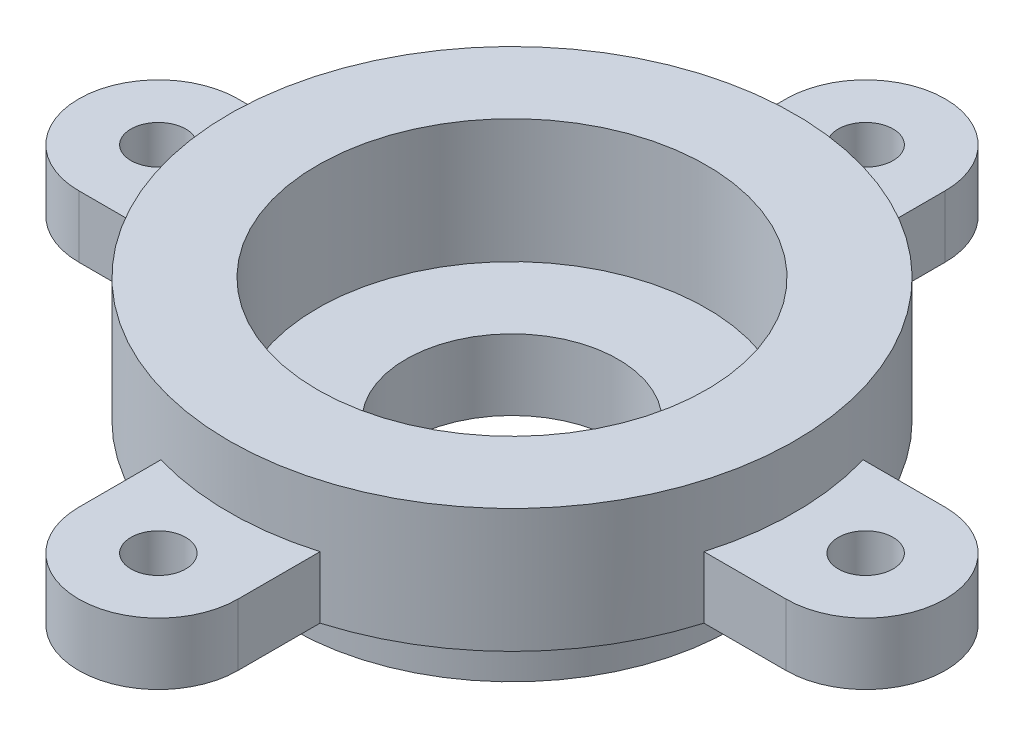
from build123d import *

# Parameters (mm, degrees)
SKETCH1_R           = 12.45
SKETCH1_R_2         = 6
BOSS_EXTRUDE1_DEPTH = 4
SKETCH2_R           = 16
SKETCH2_R_2         = 11
BOSS_EXTRUDE2_DEPTH = 7
BOSS_EXTRUDE3_START = -7
SKETCH3_R           = 1.55
BOSS_EXTRUDE3_DEPTH = 3.5
CIRPATTERN1_COUNT   = 4


with BuildPart() as part:
    # Sketch1 → Boss-Extrude1 (new body)
    with BuildSketch(Plane(origin=(0, 0, 0), x_dir=(1, 0, 0), z_dir=(0, 1, 0))):
        with Locations(Location((0, 0, 0), (0, 0, 270))):
            Circle(SKETCH1_R)
        with Locations(Location((0, 0, 0), (0, 0, 270))):
            Circle(SKETCH1_R_2, mode=Mode.SUBTRACT)
    extrude(amount=BOSS_EXTRUDE1_DEPTH)

    # Sketch2 → Boss-Extrude2 (add)
    with BuildSketch(Plane(origin=(0, 4, 0), x_dir=(1, 0, 0), z_dir=(0, 1, 0))):
        with Locations(Location((0, 0, 0), (0, 0, 270))):
            Circle(SKETCH2_R)
        with Locations(Location((0, 0, 0), (0, 0, 270))):
            Circle(SKETCH2_R_2, mode=Mode.SUBTRACT)
    extrude(amount=BOSS_EXTRUDE2_DEPTH)

    # Sketch3 → Boss-Extrude3 (add)
    with BuildSketch(Plane(origin=(0, 11, 0), x_dir=(1, 0, 0), z_dir=(0, 1, 0)).offset(BOSS_EXTRUDE3_START)):
        with BuildLine():
            Line((-4.5, 20), (-4.5, 15.354152533))
            ThreePointArc((-4.5, 15.354152533), (0, 16), (4.5, 15.354152533))
            Line((4.5, 15.354152533), (4.5, 20))
            ThreePointArc((4.5, 20), (0, 24.5), (-4.5, 20))
        make_face()
        with Locations(Location((0, 20, 0), (0, 0, 270))):
            Circle(SKETCH3_R, mode=Mode.SUBTRACT)
    boss_extrude3 = extrude(amount=BOSS_EXTRUDE3_DEPTH)

    # CirPattern1: Boss-Extrude3 ×4 about axis
    cirpattern1_axis = Axis((0, 0, 0), (0, 1, 0))
    for i in range(1, CIRPATTERN1_COUNT):
        add(boss_extrude3.rotate(cirpattern1_axis, i * 360 / CIRPATTERN1_COUNT))


solid = part.part
